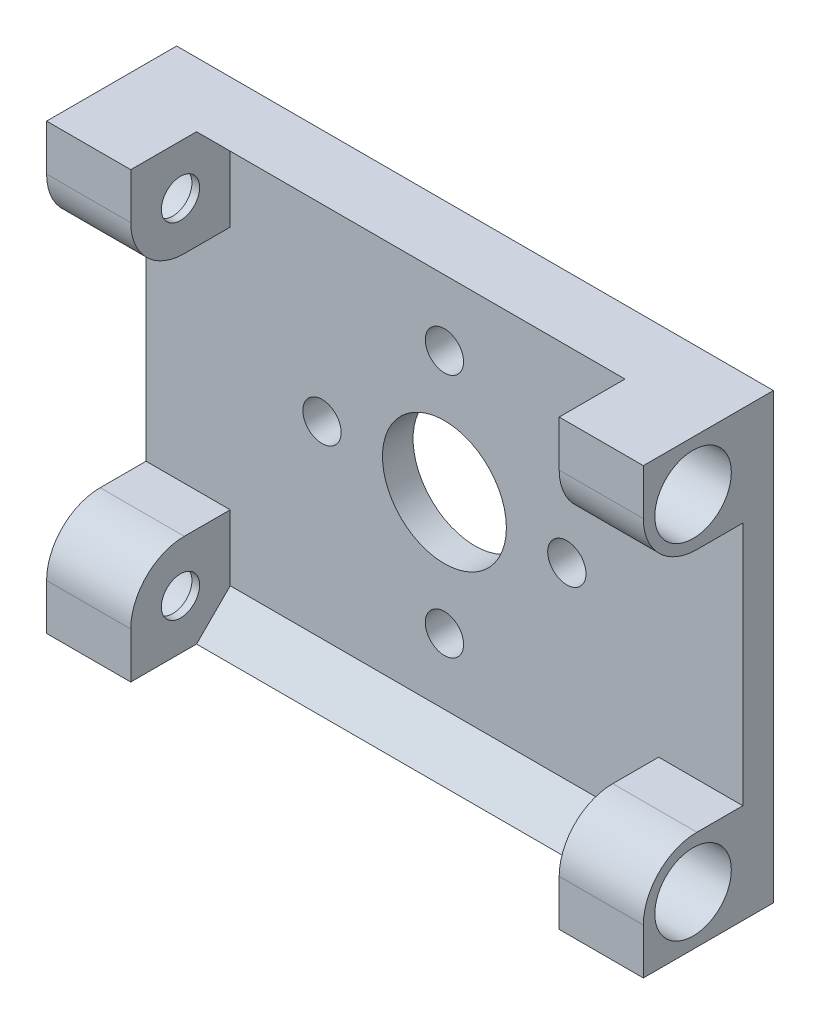
from build123d import *

# Parameters (mm, degrees)
SKETCH1_W           = 39
SKETCH1_H           = 23.712741858
BOSS_EXTRUDE1_DEPTH = 2
SKETCH9_R           = 4.05
CUT_EXTRUDE6_DEPTH  = 5
SKETCH10_R          = 1.25
BOSS_EXTRUDE5_DEPTH = 5.5
SKETCH11_R          = 2.5
CUT_EXTRUDE7_DEPTH  = 5
BOSS_EXTRUDE6_START = -5.5
SKETCH12_R          = 2.5
BOSS_EXTRUDE6_DEPTH = 5.5
BOSS_EXTRUDE7_DEPTH = 28


with BuildPart() as part:
    # Sketch1 → Boss-Extrude1 (new body)
    with BuildSketch(Plane.XY):
        with Locations((0, -11)):
            Rectangle(SKETCH1_W, SKETCH1_H)
        with BuildLine():
            ThreePointArc((1.25, -19), (0, -17.75), (-1.25, -19))
            ThreePointArc((-1.25, -19), (0, -20.25), (1.25, -19))
        make_face(mode=Mode.SUBTRACT)
        with BuildLine():
            ThreePointArc((-6.75, -11), (-8, -9.75), (-9.25, -11))
            ThreePointArc((-9.25, -11), (-8, -12.25), (-6.75, -11))
        make_face(mode=Mode.SUBTRACT)
        with BuildLine():
            ThreePointArc((1.25, -3), (0, -1.75), (-1.25, -3))
            ThreePointArc((-1.25, -3), (0, -4.25), (1.25, -3))
        make_face(mode=Mode.SUBTRACT)
        with BuildLine():
            ThreePointArc((9.25, -11), (8, -9.75), (6.75, -11))
            ThreePointArc((6.75, -11), (8, -12.25), (9.25, -11))
        make_face(mode=Mode.SUBTRACT)
    extrude(amount=BOSS_EXTRUDE1_DEPTH)

    # Sketch9 → Cut-Extrude6 (cut)
    with BuildSketch(Plane.XY.offset(2)):
        with Locations((0, -11)):
            Circle(SKETCH9_R)
    extrude(amount=-CUT_EXTRUDE6_DEPTH, mode=Mode.SUBTRACT)

    # Sketch10 → Boss-Extrude5 (add)
    # profile 1 of 2: a face of its own
    with BuildSketch(Plane.ZY.offset(19.5)):
        with BuildLine():
            Line((4.2, 3.5), (8.5, 3.5))
            Line((8.5, 3.5), (8.5, 0.5))
            ThreePointArc((8.5, 0.5), (7.474873734, -1.974873734), (5, -3))
            Line((5, -3), (2, -3))
            Line((2, -3), (2, 0.856370929))
            Line((2, 0.856370929), (0, 0.856370929))
            Line((0, 0.856370929), (0, 3.5))
            Line((0, 3.5), (4.2, 3.5))
        make_face()
        with Locations((5.25, 0.25)):
            Circle(SKETCH10_R, mode=Mode.SUBTRACT)
    # profile 2 of 2: a face of its own
    with BuildSketch(Plane.ZY.offset(19.5)):
        with BuildLine():
            Line((5, -19), (2, -19))
            Line((2, -19), (2, -22.856370929))
            Line((2, -22.856370929), (0, -22.856370929))
            Line((0, -22.856370929), (0, -25.5))
            Line((0, -25.5), (4.2, -25.5))
            Line((4.2, -25.5), (8.5, -25.5))
            Line((8.5, -25.5), (8.5, -22.5))
            ThreePointArc((8.5, -22.5), (7.474873734, -20.025126266), (5, -19))
        make_face()
        with Locations((5.25, -22.25)):
            Circle(SKETCH10_R, mode=Mode.SUBTRACT)
    extrude(amount=-BOSS_EXTRUDE5_DEPTH)

    # Sketch11 → Cut-Extrude7 (cut)
    with BuildSketch(Plane.ZY.offset(19.5)):
        with Locations((5.25, 0.25)):
            Circle(SKETCH11_R)
        with Locations(Location((5.25, -22.25, 0), (0, 0, 180))):
            Circle(SKETCH11_R)
    extrude(amount=-CUT_EXTRUDE7_DEPTH, mode=Mode.SUBTRACT)

    # Sketch12 → Boss-Extrude6 (add)
    with BuildSketch(Plane(origin=(19.5, 0, 0), x_dir=(0, 0, -1), z_dir=(1, 0, 0)).offset(BOSS_EXTRUDE6_START)):
        with BuildLine():
            ThreePointArc((-8.5, 0.5), (-7.474873734, -1.974873734), (-5, -3))
            Line((-5, -3), (-2, -3))
            Line((-2, -3), (-2, -19))
            Line((-2, -19), (-5, -19))
            ThreePointArc((-5, -19), (-7.474873734, -20.025126266), (-8.5, -22.5))
            Line((-8.5, -22.5), (-8.5, -25.5))
            Line((-8.5, -25.5), (0, -25.5))
            Line((0, -25.5), (0, 3.5))
            Line((0, 3.5), (-8.5, 3.5))
            Line((-8.5, 3.5), (-8.5, 0.5))
        make_face()
        with Locations((-5.25, -22.25)):
            Circle(SKETCH12_R, mode=Mode.SUBTRACT)
        with Locations(Location((-5.25, 0.25, 0), (0, 0, 180))):
            Circle(SKETCH12_R, mode=Mode.SUBTRACT)
    extrude(amount=BOSS_EXTRUDE6_DEPTH)

    # Sketch13 → Boss-Extrude7 (add)
    with BuildSketch(Plane.ZY.offset(-14)):
        Polygon((0, 3.5), (4.2, 3.5), (2, 1.3), (2, 0.856370929), (0, 0.856370929), align=None)
        Polygon((2, -22.856370929), (0, -22.856370929), (0, -25.5), (4.2, -25.5), (2, -23.3), align=None)
    extrude(amount=BOSS_EXTRUDE7_DEPTH)


solid = part.part
